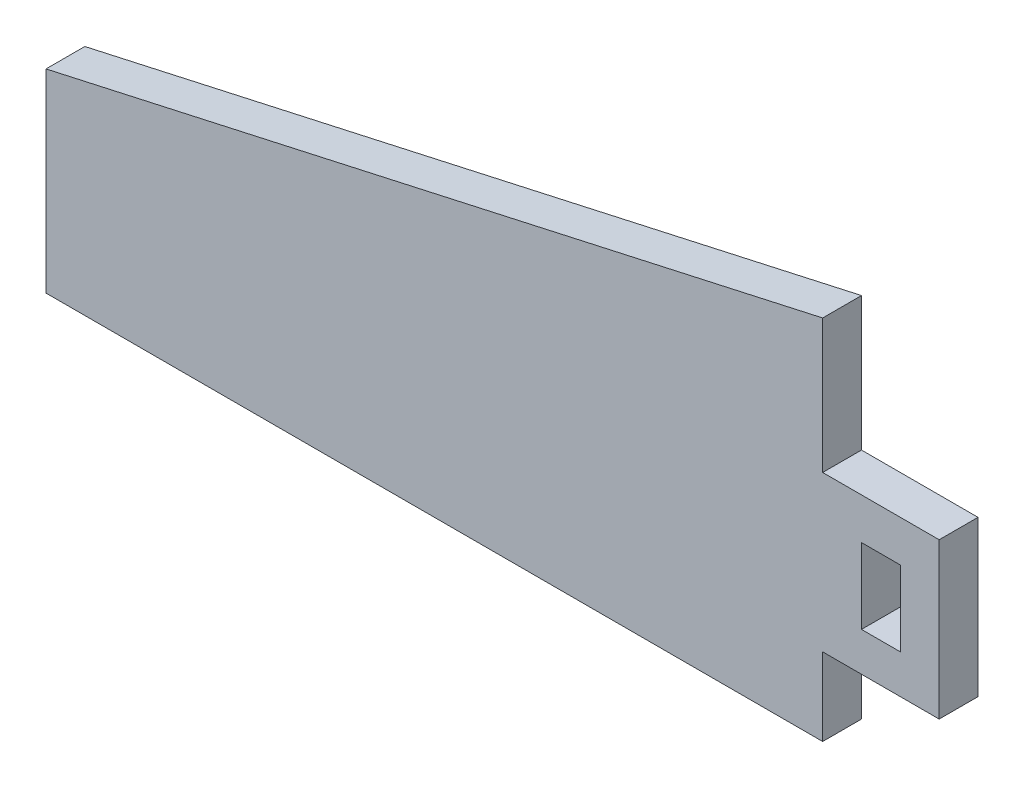
from build123d import *

# Parameters (mm, degrees)
SKETCH1_W           = 5
SKETCH1_H           = 9.685479934
BOSS_EXTRUDE1_DEPTH = 5


with BuildPart() as part:
    # Sketch1 → Boss-Extrude1 (new body)
    with BuildSketch(Plane.XY):
        Polygon((100, 30), (100, 47.229662795), (0, 25), (0, 0), (100, 0), (100, 10), (115, 10), (115, 30), align=None)
        with Locations((107.5, 19.842739967)):
            Rectangle(SKETCH1_W, SKETCH1_H, mode=Mode.SUBTRACT)
    extrude(amount=BOSS_EXTRUDE1_DEPTH)


solid = part.part
